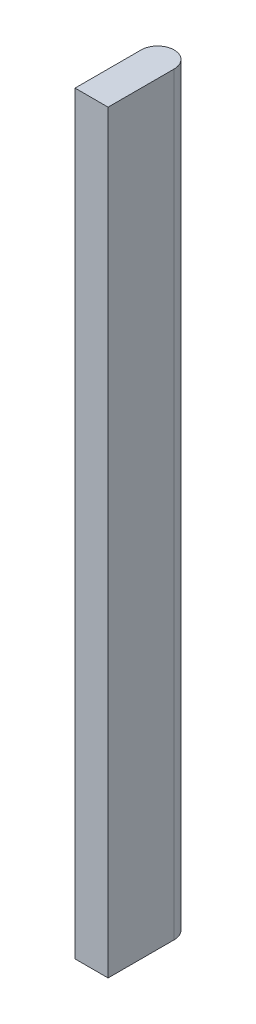
from build123d import *

# Parameters (mm, degrees)
BOSS_EXTRUDE1_DEPTH = 145


with BuildPart() as part:
    # Sketch1 → Boss-Extrude1 (new body)
    with BuildSketch(Plane(origin=(0, 0, 0), x_dir=(1, 0, 0), z_dir=(0, 1, 0))):
        with BuildLine():
            Line((0, 0), (6.35, 0))
            Line((6.35, 0), (6.35, 12.705))
            ThreePointArc((6.35, 12.705), (5.421528496, 14.946528496), (3.18, 15.875))
            Line((3.18, 15.875), (3.17, 15.875))
            ThreePointArc((3.17, 15.875), (0.928471504, 14.946528496), (0, 12.705))
            Line((0, 12.705), (0, 0))
        make_face()
    extrude(amount=BOSS_EXTRUDE1_DEPTH)


solid = part.part
